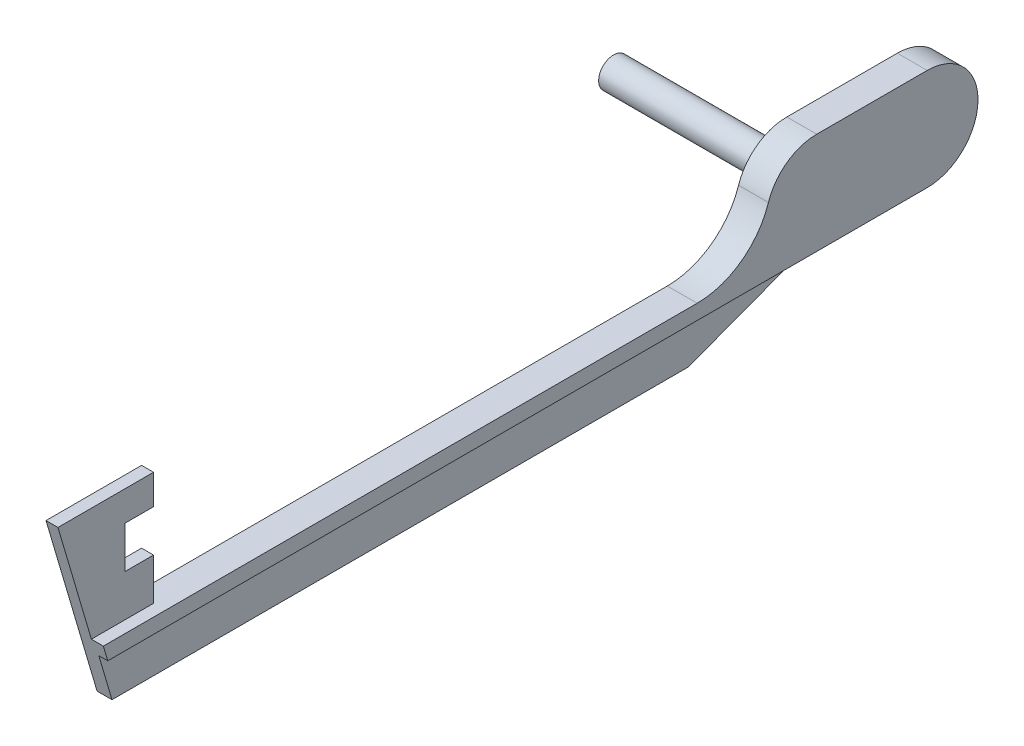
from build123d import *

# Parameters (mm, degrees)
BOSS_EXTRUDE2_DEPTH = 2.54
BOSS_EXTRUDE3_DEPTH = 1.778
BOSS_EXTRUDE4_START = 1.524
BOSS_EXTRUDE4_DEPTH = 1.27
SKETCH1_8_R         = 1.27
BOSS_EXTRUDE5_DEPTH = 14.986
SKETCH2_W           = 0.508
SKETCH2_H           = 8.128
CUT_EXTRUDE1_DEPTH  = 76.866530328


with BuildPart() as part:
    # Sketch1 → Boss-Extrude2 (new body)
    with BuildSketch(Plane(origin=(0, 0, 0), x_dir=(0, 0, -1), z_dir=(1, 0, 0))):
        with BuildLine():
            Line((0, 4.318), (-9.398, 4.318))
            ThreePointArc((-9.398, 4.318), (-11.932525974, 3.495897895), (-13.501957395, 1.342630889))
            ThreePointArc((-13.501957395, 1.342630889), (-15.817903355, -1.834857441), (-19.558, -3.048))
            Line((-19.558, -3.048), (-70.05358602, -3.048))
            Line((-70.05358602, -3.048), (-69.679321023, -4.318))
            Line((-69.679321023, -4.318), (0, -4.318))
            ThreePointArc((0, -4.318), (4.318, 0), (0, 4.318))
        make_face()
    extrude(amount=BOSS_EXTRUDE2_DEPTH)

    # Sketch1<5> → Boss-Extrude3 (add)
    with BuildSketch(Plane(origin=(0, 0, 0), x_dir=(0, 0, -1), z_dir=(1, 0, 0))):
        Polygon((-19.558, -8.128), (-9.398, -4.318), (-69.679321023, -4.318), (-68.55652603, -8.128), align=None)
    extrude(amount=BOSS_EXTRUDE3_DEPTH)

    # Sketch1<7> → Boss-Extrude4 (add)
    with BuildSketch(Plane(origin=(0, 0, 0), x_dir=(0, 0, -1), z_dir=(1, 0, 0)).offset(BOSS_EXTRUDE4_START)):
        Polygon((-70.05358602, -3.048), (-64.77, -3.048), (-64.77, 0.508), (-67.200502007, 0.508), (-67.200502007, 4.064), (-64.77, 4.064), (-64.77, 6.604), (-72.898, 6.604), align=None)
    extrude(amount=-BOSS_EXTRUDE4_DEPTH)

    # Sketch1<8> → Boss-Extrude5 (add)
    with BuildSketch(Plane(origin=(0, 0, 0), x_dir=(0, 0, -1), z_dir=(1, 0, 0))):
        with Locations((-9.144, 0)):
            Circle(SKETCH1_8_R)
    extrude(amount=-BOSS_EXTRUDE5_DEPTH)

    # Sketch2 → Cut-Extrude1 (cut, through all)
    with BuildSketch(Plane(origin=(0, 6.604, 0), x_dir=(1, 0, 0), z_dir=(0, 1, 0))):
        with Locations((0.254, -68.834)):
            Rectangle(SKETCH2_W, SKETCH2_H)
    extrude(amount=-CUT_EXTRUDE1_DEPTH, mode=Mode.SUBTRACT)


solid = part.part
